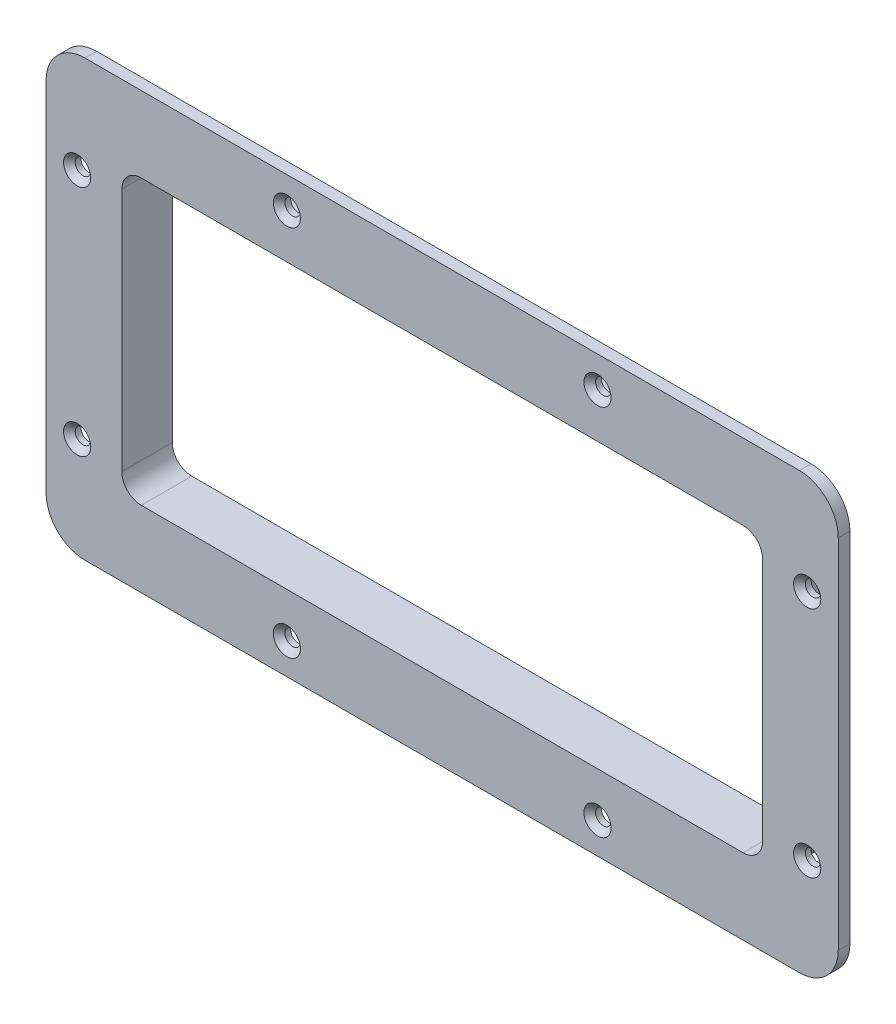
from build123d import *

# Parameters (mm, degrees)
ESQUISSE1_W                  = 172
ESQUISSE1_H                  = 80
ESQUISSE1_W_2                = 165
ESQUISSE1_H_2                = 73
BOSS_EXTRU_1_DEPTH           = 10
ESQUISSE2_W                  = 204
ESQUISSE2_H                  = 112
ESQUISSE2_W_2                = 165
ESQUISSE2_H_2                = 73
BOSS_EXTRU_2_DEPTH           = 3
CONG_1_R                     = 10
CONG_2_R                     = 5
ENL_V_MAT_EXTRU_1_DEPTH      = 212.329127193
ENL_V_MAT_EXTRU_1_DEPTH_BACK = 2
ESQUISSE3_R                  = 3.5
ENL_V_MAT_EXTRU_2_DEPTH      = 212.492316645
ENL_V_MAT_EXTRU_2_DEPTH_BACK = 212.492316645
ESQUISSE4_R                  = 2
CHANFREIN1_SIZE              = 1.5


with BuildPart() as part:
    # Esquisse1 → Boss.-Extru.1 (new body)
    with BuildSketch(Plane.XY):
        with Locations((86, 40)):
            Rectangle(ESQUISSE1_W, ESQUISSE1_H)
        with Locations((86, 40)):
            Rectangle(ESQUISSE1_W_2, ESQUISSE1_H_2, mode=Mode.SUBTRACT)
    extrude(amount=BOSS_EXTRU_1_DEPTH)

    # Esquisse2 → Boss.-Extru.2 (add)
    with BuildSketch(Plane.XY.offset(10)):
        with Locations((86, 40)):
            Rectangle(ESQUISSE2_W, ESQUISSE2_H)
        with Locations((86, 40)):
            Rectangle(ESQUISSE2_W_2, ESQUISSE2_H_2, mode=Mode.SUBTRACT)
    extrude(amount=BOSS_EXTRU_2_DEPTH)

    # Congé1
    cong_1_edges = [part.edges().sort_by_distance(p)[0] for p in [
        (-16, 96, 11.5),
        (-16, -16, 11.5),
        (188, -16, 11.5),
        (188, 96, 11.5),
    ]]
    fillet(cong_1_edges, radius=CONG_1_R)

    # Congé2
    cong_2_edges = [part.edges().sort_by_distance(p)[0] for p in [
        (3.5, 76.5, 6.5),
        (3.5, 3.5, 6.5),
        (168.5, 3.5, 6.5),
        (168.5, 76.5, 6.5),
        (0, 80, 5),
        (172, 80, 5),
        (172, 0, 5),
        (0, 0, 5),
    ]]
    fillet(cong_2_edges, radius=CONG_2_R)

    # Esquisse3 → Enlèv. mat.-Extru.1 (cut, two sides: drawn at the far end of the back side and taken through both)
    with BuildSketch(Plane(origin=(0, 0, 10), x_dir=(-1, 0, 0), z_dir=(0, 0, -1)).offset(-ENL_V_MAT_EXTRU_1_DEPTH_BACK)):
        with Locations(Location((-180, 40, 0), (0, 0, 180))):
            Circle(ESQUISSE3_R)
        with Locations(Location((8, 40, 0), (0, 0, 180))):
            Circle(ESQUISSE3_R)
        with Locations(Location((-86, -8, 0), (0, 0, 180))):
            Circle(ESQUISSE3_R)
        with Locations(Location((-86, 88, 0), (0, 0, 180))):
            Circle(ESQUISSE3_R)
    extrude(amount=ENL_V_MAT_EXTRU_1_DEPTH + ENL_V_MAT_EXTRU_1_DEPTH_BACK, mode=Mode.SUBTRACT)

    # Esquisse4 → Enlèv. mat.-Extru.2 (cut, two sides: drawn at the far end of the back side and taken through both)
    with BuildSketch(Plane.XY.offset(13).offset(-ENL_V_MAT_EXTRU_2_DEPTH_BACK)):
        with Locations((-8, 70)):
            Circle(ESQUISSE4_R)
        with Locations((-8, 10)):
            Circle(ESQUISSE4_R)
        with Locations((180, 10)):
            Circle(ESQUISSE4_R)
        with Locations((180, 70)):
            Circle(ESQUISSE4_R)
        with Locations((46, 88)):
            Circle(ESQUISSE4_R)
        with Locations((126, 88)):
            Circle(ESQUISSE4_R)
        with Locations((126, -8)):
            Circle(ESQUISSE4_R)
        with Locations((46, -8)):
            Circle(ESQUISSE4_R)
    extrude(amount=ENL_V_MAT_EXTRU_2_DEPTH + ENL_V_MAT_EXTRU_2_DEPTH_BACK, mode=Mode.SUBTRACT)

    # Chanfrein1
    chanfrein1_edges = [part.edges().sort_by_distance(p)[0] for p in [
        (-10, 70, 13),
        (44, -8, 13),
        (124, -8, 13),
        (124, 88, 13),
        (44, 88, 13),
        (178, 70, 13),
        (178, 10, 13),
        (-10, 10, 13),
    ]]
    chamfer(chanfrein1_edges, length=CHANFREIN1_SIZE)


solid = part.part
